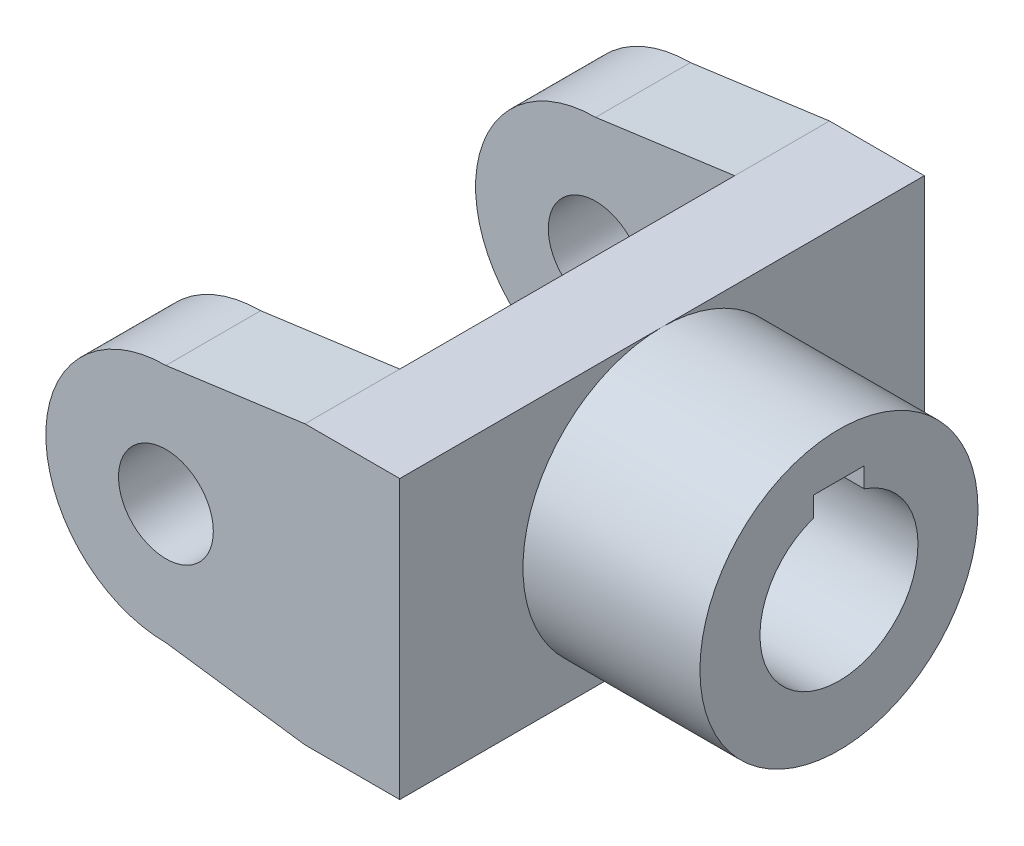
from build123d import *

# Parameters (mm, degrees)
SKETCH1_W           = 56
SKETCH1_H           = 88
BOSS_EXTRUDE1_DEPTH = 44
SKETCH1_3_R         = 15
BOSS_EXTRUDE2_DEPTH = 83
SKETCH2_W           = 82
SKETCH2_H           = 106
CUT_EXTRUDE1_DEPTH  = 83
CUT_EXTRUDE2_DEPTH  = 56
SKETCH3_4_R         = 25
CUT_EXTRUDE3_DEPTH  = 196
CUT_EXTRUDE6_DEPTH  = 246


with BuildPart() as part:
    # Sketch1 → Boss-Extrude1 (new, symmetric)
    with BuildSketch(Plane.XY):
        Rectangle(SKETCH1_W, SKETCH1_H)
    extrude(amount=BOSS_EXTRUDE1_DEPTH, both=True)

    # Sketch1<3> → Boss-Extrude2 (add, symmetric)
    with BuildSketch(Plane.XY):
        with BuildLine():
            Line((-28, -44), (-28, 44))
            Line((-28, 44), (-58, 44))
            Line((-58, 44), (-102, 38))
            ThreePointArc((-102, 38), (-140, 0), (-102, -38))
            Line((-102, -38), (-58, -44))
            Line((-58, -44), (-28, -44))
        make_face()
        with Locations((-102, 0)):
            Circle(SKETCH1_3_R, mode=Mode.SUBTRACT)
    extrude(amount=BOSS_EXTRUDE2_DEPTH, both=True)

    # Sketch2 → Cut-Extrude1 (cut, symmetric)
    with BuildSketch(Plane(origin=(0, 0, 0), x_dir=(1, 0, 0), z_dir=(0, 1, 0))):
        with Locations((-99, 0)):
            Rectangle(SKETCH2_W, SKETCH2_H)
    extrude(amount=CUT_EXTRUDE1_DEPTH, both=True, mode=Mode.SUBTRACT)

    # Sketch3 → Cut-Extrude2 (cut)
    with BuildSketch(Plane(origin=(28, 0, 0), x_dir=(0, 0, -1), z_dir=(1, 0, 0))):
        with BuildLine():
            Line((-44, 44), (-44, 0))
            ThreePointArc((-44, 0), (-31.112698372, 31.112698372), (0, 44))
            Line((0, 44), (-44, 44))
        make_face()
        with BuildLine():
            ThreePointArc((0, -44), (-31.112698372, -31.112698372), (-44, 0))
            Line((-44, 0), (-44, -44))
            Line((-44, -44), (0, -44))
        make_face()
        with BuildLine():
            Line((44, 44), (0, 44))
            ThreePointArc((0, 44), (31.112698372, 31.112698372), (44, 0))
            Line((44, 0), (44, 44))
        make_face()
        with BuildLine():
            ThreePointArc((44, 0), (31.112698372, -31.112698372), (0, -44))
            Line((0, -44), (44, -44))
            Line((44, -44), (44, 0))
        make_face()
    extrude(amount=-CUT_EXTRUDE2_DEPTH, mode=Mode.SUBTRACT)

    # Sketch3<4> → Cut-Extrude3 (cut)
    with BuildSketch(Plane(origin=(28, 0, 0), x_dir=(0, 0, -1), z_dir=(1, 0, 0))):
        Circle(SKETCH3_4_R)
    extrude(amount=-CUT_EXTRUDE3_DEPTH, mode=Mode.SUBTRACT)

    # Sketch5 → Cut-Extrude6 (cut)
    with BuildSketch(Plane(origin=(28, 0, 0), x_dir=(0, 0, -1), z_dir=(1, 0, 0))):
        with BuildLine():
            Line((8, 30), (-8, 30))
            Line((-8, 30), (-8, 23.685438565))
            ThreePointArc((-8, 23.685438565), (-6.020486484, 24.264248237), (-4, 24.677925359))
            ThreePointArc((-4, 24.677925359), (0, 25), (4, 24.677925359))
            ThreePointArc((4, 24.677925359), (6.020486484, 24.264248237), (8, 23.685438565))
            Line((8, 23.685438565), (8, 30))
        make_face()
    extrude(amount=-CUT_EXTRUDE6_DEPTH, mode=Mode.SUBTRACT)


solid = part.part
